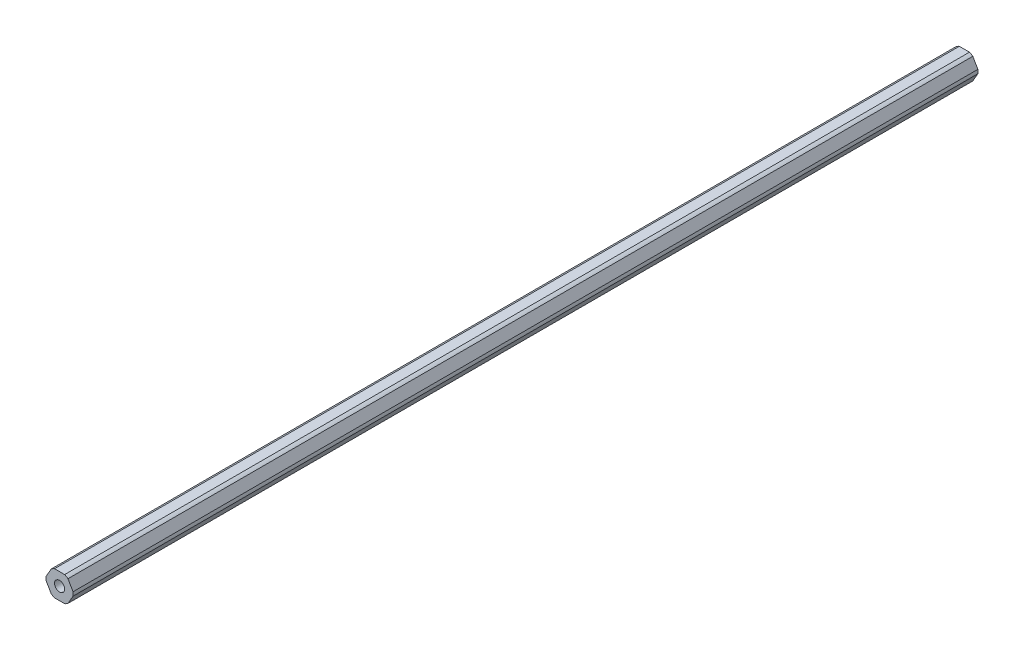
from build123d import *

# Parameters (mm, degrees)
SKETCH1_R           = 2.55
BOSS_EXTRUDE1_DEPTH = 457.2


with BuildPart() as part:
    # Sketch1 → Boss-Extrude1 (new body)
    with BuildSketch(Plane.XY.offset(228.6)):
        with BuildLine():
            Line((4.241495213, -5.404314791), (6.801021505, -0.971085209))
            ThreePointArc((6.801021505, -0.971085209), (6.87, 0), (6.801021505, 0.971085209))
            Line((6.801021505, 0.971085209), (4.241495213, 5.404314791))
            ThreePointArc((4.241495213, 5.404314791), (3.435, 5.949594524), (2.559526292, 6.3754))
            Line((2.559526292, 6.3754), (-2.559526292, 6.3754))
            ThreePointArc((-2.559526292, 6.3754), (-3.435, 5.949594524), (-4.241495213, 5.404314791))
            Line((-4.241495213, 5.404314791), (-6.801021505, 0.971085209))
            ThreePointArc((-6.801021505, 0.971085209), (-6.87, 0), (-6.801021505, -0.971085209))
            Line((-6.801021505, -0.971085209), (-4.241495213, -5.404314791))
            ThreePointArc((-4.241495213, -5.404314791), (-3.435, -5.949594524), (-2.559526292, -6.3754))
            Line((-2.559526292, -6.3754), (2.559526292, -6.3754))
            ThreePointArc((2.559526292, -6.3754), (3.435, -5.949594524), (4.241495213, -5.404314791))
        make_face()
        Circle(SKETCH1_R, mode=Mode.SUBTRACT)
    extrude(amount=-BOSS_EXTRUDE1_DEPTH)


solid = part.part
